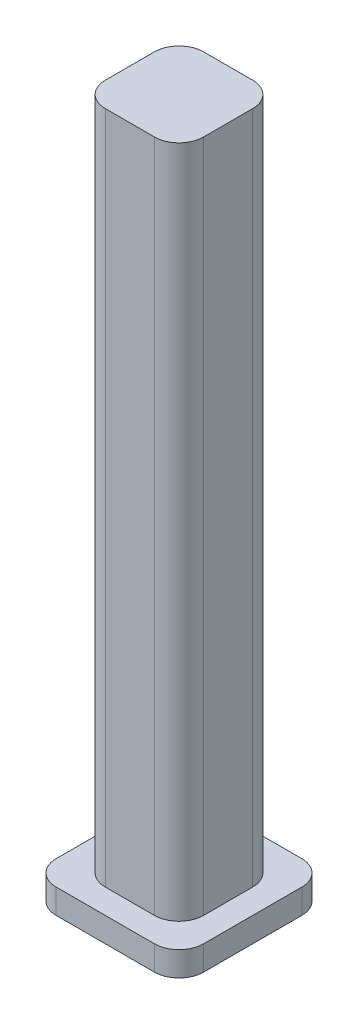
from build123d import *

# Parameters (mm, degrees)
SKETCH1_W           = 60
SKETCH1_H           = 60
BOSS_EXTRUDE1_DEPTH = 10
SKETCH2_W           = 40
SKETCH2_H           = 40
BOSS_EXTRUDE2_DEPTH = 284.35549
FILLET1_R           = 10


with BuildPart() as part:
    # Sketch1 → Boss-Extrude1 (new body)
    with BuildSketch(Plane(origin=(0, 0, 0), x_dir=(1, 0, 0), z_dir=(0, 1, 0))):
        Rectangle(SKETCH1_W, SKETCH1_H)
    extrude(amount=BOSS_EXTRUDE1_DEPTH)

    # Sketch2 → Boss-Extrude2 (add)
    with BuildSketch(Plane(origin=(0, 0, 0), x_dir=(1, 0, 0), z_dir=(0, 1, 0))):
        Rectangle(SKETCH2_W, SKETCH2_H)
    extrude(amount=BOSS_EXTRUDE2_DEPTH)

    # Fillet1
    fillet1_edges = [part.edges().sort_by_distance(p)[0] for p in [
        (20, 147.177745, 20),
        (20, 147.177745, -20),
        (-20, 147.177745, -20),
        (-20, 147.177745, 20),
        (30, 5, 30),
        (-30, 5, 30),
        (-30, 5, -30),
        (30, 5, -30),
    ]]
    fillet(fillet1_edges, radius=FILLET1_R)


solid = part.part
